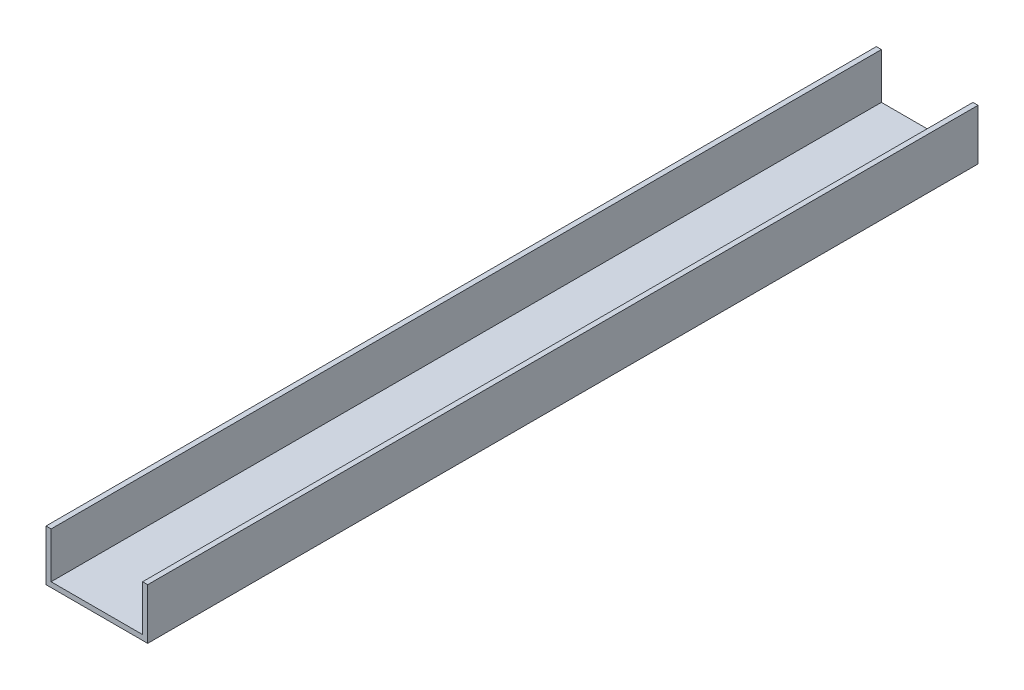
from build123d import *

# Parameters (mm, degrees)
ESTRUSIONE_ESTRUSIONE1_DEPTH = 490


with BuildPart() as part:
    # Schizzo1 → Estrusione-Estrusione1 (new body)
    with BuildSketch(Plane.XY):
        Polygon((-22.986722187, -3.313953488), (37.013277813, -3.313953488), (37.013277813, 26.686046512), (34.013277813, 26.686046512), (34.013277813, -0.313953488), (-19.986722187, -0.313953488), (-19.986722187, 26.686046512), (-22.986722187, 26.686046512), align=None)
    extrude(amount=ESTRUSIONE_ESTRUSIONE1_DEPTH)


solid = part.part
